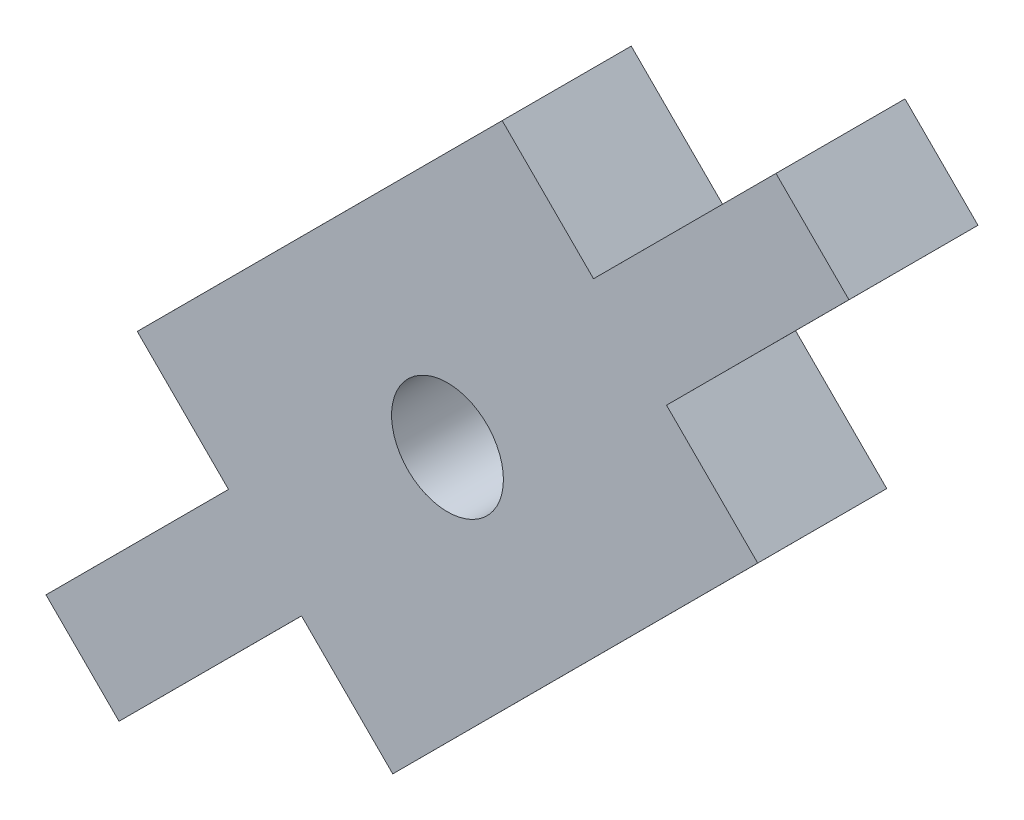
from build123d import *

# Parameters (mm, degrees)
SKETCH_1_R      = 1.3
EXTRUDE_1_DEPTH = 3


with BuildPart() as part:
    # 草图1 → 凸台-拉伸1 (new body)
    with BuildSketch(Plane.XY.offset(-0.362857667)):
        Polygon((6.931968366, 27.685420414), (4.808443123, 29.808337985), (-3.675778765, 21.321687543), (-1.554532399, 19.201048196), (-5.797509256, 14.956856814), (-4.099819599, 13.25965297), (0.142530428, 17.503217343), (2.264294404, 15.382060533), (10.749072595, 23.869267436), (8.629080401, 25.98865297), (12.870428791, 30.231215419), (11.173246227, 31.927912314), align=None)
        with Locations((3.536567574, 22.593983824)):
            Circle(SKETCH_1_R, mode=Mode.SUBTRACT)
    extrude(amount=-EXTRUDE_1_DEPTH)


solid = part.part
